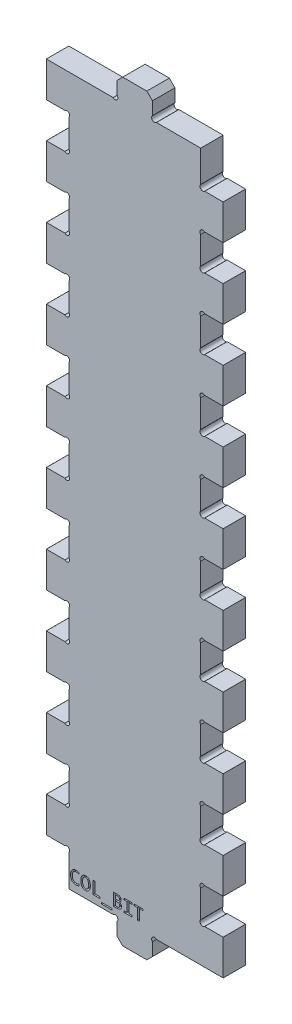
from build123d import *

# Parameters (mm, degrees)
SKETCH1_W           = 50.000000076
SKETCH1_H           = 200.000108
BOSS_EXTRUDE1_DEPTH = 6.35
SKETCH2_W           = 10.0000054
SKETCH2_H           = 6.35
BOSS_EXTRUDE2_DEPTH = 6.35
SKETCH8_W           = 6.35
SKETCH8_H           = 10.0000054
CUT_EXTRUDE6_DEPTH  = 213.416311942
LPATTERN4_COUNT     = 10
LPATTERN4_PITCH     = 20.0000108
SKETCH9_R           = 0.79375
CUT_EXTRUDE7_DEPTH  = 213.416311942
LPATTERN5_COUNT     = 9
LPATTERN5_PITCH     = 20.0000108
SKETCH10_R          = 0.79375
CUT_EXTRUDE8_DEPTH  = 213.416311942
CHAMFER1_SIZE       = 1.5875
SKETCH11_R          = 0.79375
CUT_EXTRUDE10_DEPTH = 213.416311942
SKETCH12_W          = 2.992753623
SKETCH12_H          = 0.405797101
CUT_EXTRUDE11_DEPTH = 2.54
SKETCH14_W          = 6.3240118
SKETCH14_H          = 10.0254054
CUT_EXTRUDE13_DEPTH = 213.416312063
LPATTERN7_COUNT     = 10
LPATTERN7_PITCH     = 20.0000108


with BuildPart() as part:
    # Sketch1 → Boss-Extrude1 (new body)
    with BuildSketch(Plane.XY):
        with Locations((25.000000038, 100.000054)):
            Rectangle(SKETCH1_W, SKETCH1_H)
    extrude(amount=BOSS_EXTRUDE1_DEPTH)

    # Sketch2 → Boss-Extrude2 (add)
    with BuildSketch(Plane.XY):
        with Locations((25.000000038, 203.175108)):
            Rectangle(SKETCH2_W, SKETCH2_H)
        with Locations((25.000000038, -3.175)):
            Rectangle(SKETCH2_W, SKETCH2_H)
    extrude(amount=BOSS_EXTRUDE2_DEPTH)

    # Sketch8 → Cut-Extrude6 (cut, through all)
    with BuildSketch(Plane.XY.offset(6.35)):
        with Locations((3.175, 5.0000027)):
            Rectangle(SKETCH8_W, SKETCH8_H)
        with Locations((46.825000076, 15.0000081)):
            Rectangle(SKETCH8_W, SKETCH8_H)
    cut_extrude6 = extrude(amount=-CUT_EXTRUDE6_DEPTH, mode=Mode.SUBTRACT)

    # LPattern4: Cut-Extrude6 ×10
    with Locations(*[(0, i * LPATTERN4_PITCH, 0) for i in range(1, LPATTERN4_COUNT)]):
        add(cut_extrude6, mode=Mode.SUBTRACT)

    # Sketch9 → Cut-Extrude7 (cut, through all)
    with BuildSketch(Plane.XY.offset(6.35)):
        with Locations((5.788733992, 29.438750192)):
            Circle(SKETCH9_R)
        with Locations((5.788733992, 20.561276808)):
            Circle(SKETCH9_R)
        with Locations((44.211266084, 19.438744792)):
            Circle(SKETCH9_R)
        with Locations((44.211266084, 10.561271408)):
            Circle(SKETCH9_R)
    cut_extrude7 = extrude(amount=-CUT_EXTRUDE7_DEPTH, mode=Mode.SUBTRACT)

    # LPattern5: Cut-Extrude7 ×9
    with Locations(*[(0, i * LPATTERN5_PITCH, 0) for i in range(1, LPATTERN5_COUNT)]):
        add(cut_extrude7, mode=Mode.SUBTRACT)

    # Sketch10 → Cut-Extrude8 (cut, through all)
    with BuildSketch(Plane.XY.offset(6.35)):
        with Locations((5.788733992, 9.438739392)):
            Circle(SKETCH10_R)
        with Locations((44.211266084, 190.561368608)):
            Circle(SKETCH10_R)
    extrude(amount=-CUT_EXTRUDE8_DEPTH, mode=Mode.SUBTRACT)

    # Chamfer1
    chamfer1_edges = [part.edges().sort_by_distance(p)[0] for p in [
        (30.000002738, 206.350108, 3.175),
        (19.999997338, 206.350108, 3.175),
        (19.999997338, -6.35, 3.175),
        (30.000002738, -6.35, 3.175),
    ]]
    chamfer(chamfer1_edges, length=CHAMFER1_SIZE)

    # Sketch11 → Cut-Extrude10 (cut, through all)
    with BuildSketch(Plane.XY):
        with Locations((19.43873133, 200.561374008)):
            Circle(SKETCH11_R)
        with Locations((30.561268746, 200.561374008)):
            Circle(SKETCH11_R)
        with Locations((19.43873133, -0.561266008)):
            Circle(SKETCH11_R)
        with Locations((30.561268746, -0.561266008)):
            Circle(SKETCH11_R)
    extrude(amount=CUT_EXTRUDE10_DEPTH, mode=Mode.SUBTRACT)

    # Sketch12 → Cut-Extrude11 (cut)
    # profile 1 of 7: a face of its own
    with BuildSketch(Plane.XY.offset(6.35)):
        with BuildLine():
            add(Edge.make_bspline(
                [(9.241681159, 2.133449275), (9.172051044, 2.109927689), (9.033143546, 2.063003673), (8.817184861, 2.016258906), (8.596831695, 1.986655982), (8.447883452, 1.983075114), (8.373021739, 1.981275362)],
                knots=[0, 0, 0, 0, 0.994474773, 1.983911717, 2.986709619, 4, 4, 4, 4], degree=3))
            add(Edge.make_bspline(
                [(8.373021739, 1.981275362), (8.313784998, 1.982651993), (8.198372663, 1.985334114), (8.030588838, 2.005924608), (7.873485396, 2.040845672), (7.726600188, 2.089029017), (7.590182892, 2.151662833), (7.464926827, 2.229338836), (7.350037868, 2.320024136), (7.24620649, 2.424813822), (7.15385938, 2.543315104), (7.074810551, 2.676017245), (7.006627123, 2.82128729), (6.953091148, 2.980629134), (6.908673059, 3.15233234), (6.87981115, 3.337634592), (6.861058715, 3.535914739), (6.858793273, 3.672578207), (6.857623188, 3.743163949)],
                knots=[0, 0, 0, 0, 1.072370344, 2.089324368, 3.054894172, 3.982167072, 4.883220536, 5.766007853, 6.644560033, 7.52738623, 8.430658994, 9.357672753, 10.318538922, 11.330575956, 12.396783324, 13.526066154, 14.722230158, 16, 16, 16, 16], degree=3))
            add(Edge.make_bspline(
                [(6.857623188, 3.743163949), (6.859099768, 3.811894194), (6.861991069, 3.946475335), (6.88143919, 4.143226133), (6.91603913, 4.32959635), (6.961848078, 4.505773361), (7.022537455, 4.669882056), (7.093581345, 4.8223251), (7.176989077, 4.961499651), (7.271585267, 5.087672029), (7.37787708, 5.200144093), (7.494493549, 5.299759358), (7.622442393, 5.384896086), (7.759886855, 5.456576142), (7.907409403, 5.513221896), (8.063835069, 5.552992406), (8.228717841, 5.578729312), (8.341483758, 5.581372394), (8.39917663, 5.582724638)],
                knots=[0, 0, 0, 0, 1.219579151, 2.388065895, 3.50339749, 4.580233523, 5.613961845, 6.603771101, 7.560489467, 8.487754287, 9.396405489, 10.300984393, 11.203313264, 12.1174982, 13.046432371, 14.000390303, 14.976967236, 16, 16, 16, 16], degree=3))
            add(Edge.make_bspline(
                [(8.39917663, 5.582724638), (8.438555235, 5.582309343), (8.516057544, 5.581491989), (8.629968521, 5.573830577), (8.739614404, 5.563507882), (8.878962347, 5.54070042), (9.048210995, 5.502545133), (9.177409016, 5.454467772), (9.241681159, 5.430550725)],
                knots=[0, 0, 0, 0, 0.82263702, 1.61905864, 2.384719601, 3.122514214, 4.568537041, 6, 6, 6, 6], degree=3))
            Line((9.241681159, 5.430550725), (9.241681159, 4.974028986))
            add(Edge.make_bspline(
                [(9.241681159, 4.974028986), (9.210428334, 4.990006992), (9.148495702, 5.021670049), (9.052319362, 5.062256406), (8.954683284, 5.096988724), (8.854604056, 5.125716119), (8.752002187, 5.14892655), (8.645079855, 5.16574771), (8.533556351, 5.175104658), (8.457579692, 5.176313541), (8.418990942, 5.176927536)],
                knots=[0, 0, 0, 0, 0.983614603, 1.949194672, 2.923566415, 3.886871985, 4.866016098, 5.870457402, 6.918399582, 8, 8, 8, 8], degree=3))
            add(Edge.make_bspline(
                [(8.418990942, 5.176927536), (8.379540437, 5.176079098), (8.302305834, 5.174418059), (8.189514247, 5.154935509), (8.082072639, 5.126356351), (7.980910785, 5.084530852), (7.886034111, 5.032502436), (7.799180636, 4.967955487), (7.718683438, 4.894297811), (7.646257974, 4.809542217), (7.582015154, 4.714734893), (7.525707459, 4.609928391), (7.476212546, 4.495595378), (7.436612374, 4.370856667), (7.40360209, 4.237288013), (7.381151341, 4.0943738), (7.367596447, 3.942363856), (7.365795755, 3.838037954), (7.364869565, 3.784377717)],
                knots=[0, 0, 0, 0, 0.961408976, 1.882207611, 2.784411545, 3.668921893, 4.545980223, 5.417431557, 6.302341026, 7.202770486, 8.13058038, 9.09095177, 10.101446619, 11.165409356, 12.279999165, 13.455113719, 14.691032636, 16, 16, 16, 16], degree=3))
            add(Edge.make_bspline(
                [(7.364869565, 3.784377717), (7.365523252, 3.728344917), (7.366789278, 3.619823606), (7.379558455, 3.462300155), (7.400914423, 3.315410374), (7.429653576, 3.178771879), (7.46768467, 3.052738296), (7.514340084, 2.937558302), (7.569096818, 2.83261959), (7.632656016, 2.738776906), (7.704247644, 2.655174316), (7.785167308, 2.583964093), (7.872643742, 2.521558623), (7.969623736, 2.473121664), (8.07317629, 2.433337078), (8.185219091, 2.407283692), (8.304581636, 2.389932746), (8.386957714, 2.388043454), (8.429294384, 2.387072464)],
                knots=[0, 0, 0, 0, 1.34450783, 2.603970389, 3.789343747, 4.904814261, 5.951782154, 6.944310538, 7.883053746, 8.786934864, 9.658944679, 10.516661903, 11.367981323, 12.229999549, 13.110838734, 14.024275634, 14.984588823, 16, 16, 16, 16], degree=3))
            add(Edge.make_bspline(
                [(8.429294384, 2.387072464), (8.465779767, 2.387597048), (8.538107423, 2.38863697), (8.645283552, 2.399522956), (8.750137307, 2.415958868), (8.886658962, 2.446880566), (9.053174198, 2.499895316), (9.178890482, 2.559967273), (9.241681159, 2.589971014)],
                knots=[0, 0, 0, 0, 0.776705674, 1.539720753, 2.291683871, 3.035542813, 4.519362263, 6, 6, 6, 6], degree=3))
            Line((9.241681159, 2.589971014), (9.241681159, 2.133449275))
        make_face()
    # profile 2 of 7: a face of its own
    with BuildSketch(Plane.XY.offset(6.35)):
        with BuildLine():
            add(Edge.make_bspline(
                [(12.437333333, 3.804984601), (12.43601793, 3.728845569), (12.433477868, 3.581820029), (12.412555032, 3.36938994), (12.379376875, 3.172756522), (12.330969947, 2.992228254), (12.270207249, 2.827841825), (12.201632231, 2.677433039), (12.122296119, 2.542200367), (12.033425875, 2.421642575), (11.93521557, 2.316801835), (11.83024605, 2.224639641), (11.715040792, 2.149760737), (11.593748947, 2.087488378), (11.46639255, 2.040198208), (11.335297313, 2.005802001), (11.200480678, 1.985740262), (11.109574639, 1.982770552), (11.063805254, 1.981275362)],
                knots=[0, 0, 0, 0, 1.423082774, 2.747992794, 3.986236128, 5.147128242, 6.236197569, 7.259302453, 8.233395673, 9.161912359, 10.053001658, 10.914402565, 11.766421957, 12.614596425, 13.458547256, 14.300675266, 15.144423756, 16, 16, 16, 16], degree=3))
            add(Edge.make_bspline(
                [(11.063805254, 1.981275362), (11.00982167, 1.982748877), (10.90503797, 1.985609012), (10.753247627, 2.009107372), (10.61209879, 2.046739236), (10.481460474, 2.10014703), (10.362354069, 2.168847955), (10.253014391, 2.250313215), (10.155178714, 2.346380358), (10.067688025, 2.455479173), (9.991225346, 2.57801454), (9.925820989, 2.713217929), (9.870217267, 2.860721403), (9.825427788, 3.020431097), (9.790831632, 3.191607172), (9.766862896, 3.373545929), (9.751248041, 3.565618457), (9.749713701, 3.697162748), (9.748927536, 3.764563406)],
                knots=[0, 0, 0, 0, 1.030115455, 1.999483942, 2.924432069, 3.813267415, 4.685316872, 5.542716903, 6.40939724, 7.295524004, 8.206506083, 9.160640047, 10.158252241, 11.211975818, 12.323750963, 13.4892538, 14.713543989, 16, 16, 16, 16], degree=3))
            add(Edge.make_bspline(
                [(9.748927536, 3.764563406), (9.75034993, 3.839899952), (9.753100111, 3.985562242), (9.772663246, 4.196517882), (9.806314436, 4.391935553), (9.85387434, 4.571929), (9.913447346, 4.736363234), (9.982511501, 4.886261547), (10.060393977, 5.02196585), (10.149995451, 5.1415857), (10.248069311, 5.246740581), (10.353150126, 5.338639822), (10.467324173, 5.414475143), (10.587959001, 5.476661318), (10.71489283, 5.523635893), (10.845647532, 5.558318613), (10.980237662, 5.578238608), (11.071140058, 5.581222372), (11.116907609, 5.582724638)],
                knots=[0, 0, 0, 0, 1.41309666, 2.732205102, 3.969807196, 5.128608405, 6.219709524, 7.24631839, 8.221244419, 9.148965463, 10.043106611, 10.914447659, 11.761129373, 12.607796584, 13.454637821, 14.294855332, 15.141493535, 16, 16, 16, 16], degree=3))
            add(Edge.make_bspline(
                [(11.116907609, 5.582724638), (11.17088216, 5.581205794), (11.27590958, 5.578250322), (11.427896122, 5.555314891), (11.568904598, 5.516302026), (11.699067312, 5.462137448), (11.818768671, 5.393499895), (11.927876493, 5.311457627), (12.026657504, 5.216102795), (12.113534025, 5.106814066), (12.190935518, 4.985092958), (12.258438921, 4.851223539), (12.313370706, 4.70389839), (12.359381712, 4.54523559), (12.394485192, 4.375040237), (12.419706837, 4.194233125), (12.434935452, 4.003127673), (12.436520905, 3.872117664), (12.437333333, 3.804984601)],
                knots=[0, 0, 0, 0, 1.031800753, 2.007749398, 2.930678117, 3.822900438, 4.696376593, 5.562252438, 6.426830471, 7.314406963, 8.225311853, 9.18096675, 10.175487812, 11.227471919, 12.337140194, 13.495232744, 14.716489688, 16, 16, 16, 16], degree=3))
        make_face()
        with BuildLine():
            add(Edge.make_bspline(
                [(11.930086957, 3.770903986), (11.929319843, 3.821632923), (11.927816655, 3.921038275), (11.920712966, 4.066869863), (11.904833817, 4.205823063), (11.885807956, 4.337988389), (11.860060806, 4.462613221), (11.826549375, 4.578507216), (11.787612768, 4.686148555), (11.739840943, 4.784056517), (11.685155945, 4.872228152), (11.623993703, 4.951423441), (11.5538972, 5.018635198), (11.476994298, 5.07596847), (11.392299535, 5.121667179), (11.299078477, 5.154455719), (11.197470152, 5.173515246), (11.127028826, 5.175767608), (11.090752717, 5.176927536)],
                knots=[0, 0, 0, 0, 1.323673599, 2.593790554, 3.807090586, 4.970987518, 6.076778004, 7.123914636, 8.116191169, 9.059475772, 9.960330598, 10.819370074, 11.662669578, 12.485668992, 13.315223066, 14.163241623, 15.054100047, 16, 16, 16, 16], degree=3))
            add(Edge.make_bspline(
                [(11.090752717, 5.176927536), (11.055535534, 5.175461751), (10.986900043, 5.172605053), (10.887318918, 5.153125777), (10.79613613, 5.117548722), (10.712780008, 5.069316432), (10.637158324, 5.009558746), (10.569697125, 4.938452065), (10.507410026, 4.859424967), (10.453429163, 4.769728909), (10.407632774, 4.671137643), (10.365331906, 4.565176701), (10.332511626, 4.450170111), (10.303471352, 4.328407128), (10.282685987, 4.200398216), (10.267948451, 4.068117388), (10.257856916, 3.931950555), (10.256740918, 3.839876258), (10.256173913, 3.793096014)],
                knots=[0, 0, 0, 0, 0.938104053, 1.828290259, 2.688226573, 3.533173995, 4.38495139, 5.245952462, 6.138444459, 7.060521377, 8.026891732, 9.031849607, 10.096184638, 11.209149641, 12.36492099, 13.547735175, 14.754076334, 16, 16, 16, 16], degree=3))
            add(Edge.make_bspline(
                [(10.256173913, 3.793096014), (10.256797119, 3.741828752), (10.258012335, 3.641860407), (10.267069923, 3.495124897), (10.280750161, 3.355393901), (10.301327316, 3.222814719), (10.327849907, 3.098556572), (10.361167952, 2.983052236), (10.400604405, 2.876287784), (10.446937421, 2.778509345), (10.501329196, 2.690699423), (10.561953655, 2.611969745), (10.632088589, 2.54552854), (10.707136232, 2.48699193), (10.792035817, 2.442375974), (10.884293742, 2.409741059), (10.985072207, 2.39040114), (11.054737023, 2.388206869), (11.090752717, 2.387072464)],
                knots=[0, 0, 0, 0, 1.340540585, 2.613980496, 3.843097936, 5.010722051, 6.120504555, 7.163418743, 8.151508278, 9.093960035, 9.987380757, 10.848401497, 11.683877306, 12.507385072, 13.329500698, 14.179475102, 15.05881515, 16, 16, 16, 16], degree=3))
            add(Edge.make_bspline(
                [(11.090752717, 2.387072464), (11.126001249, 2.388400933), (11.194492349, 2.390982269), (11.293349403, 2.412252809), (11.384928334, 2.446356466), (11.468688325, 2.494724667), (11.545078889, 2.554430013), (11.613424744, 2.625274866), (11.675644785, 2.704784284), (11.730268109, 2.794425908), (11.778269739, 2.892425457), (11.819561695, 2.998825819), (11.854377033, 3.112719034), (11.881459116, 3.234495751), (11.903948197, 3.361899639), (11.918251486, 3.494578643), (11.928424315, 3.631253151), (11.929526842, 3.723858103), (11.930086957, 3.770903986)],
                knots=[0, 0, 0, 0, 0.936906737, 1.820494917, 2.676828052, 3.526792157, 4.383009914, 5.247809723, 6.13916262, 7.06372975, 8.034989121, 9.038664354, 10.096936984, 11.200050273, 12.355522744, 13.536827286, 14.74863997, 16, 16, 16, 16], degree=3))
        make_face(mode=Mode.SUBTRACT)
    # profile 3 of 7: a face of its own
    with BuildSketch(Plane.XY.offset(6.35)):
        Polygon((15.227188406, 2.032), (13.198202899, 2.032), (13.198202899, 5.532), (13.705449275, 5.532), (13.705449275, 2.437797101), (15.227188406, 2.437797101), align=None)
    # profile 4 of 7: a face of its own
    with BuildSketch(Plane.XY.offset(6.35)):
        with Locations((17.078637682, 1.118956522)):
            Rectangle(SKETCH12_W, SKETCH12_H)
    # profile 5 of 7: a face of its own
    with BuildSketch(Plane.XY.offset(6.35)):
        with BuildLine():
            add(Edge.make_bspline(
                [(21.26342029, 3.091669384), (21.262206874, 3.050385061), (21.259837655, 2.969776577), (21.241270646, 2.852775616), (21.211235382, 2.742746616), (21.168333223, 2.640303308), (21.113702402, 2.545643546), (21.050317486, 2.457397294), (20.975070473, 2.377922201), (20.889772489, 2.306440675), (20.794858812, 2.242795359), (20.690596084, 2.18748094), (20.577130482, 2.139609619), (20.454547718, 2.10036785), (20.323837889, 2.069809065), (20.185911584, 2.047353759), (20.04070608, 2.035042856), (19.941431185, 2.033029281), (19.890684783, 2.032)],
                knots=[0, 0, 0, 0, 1.013216857, 1.978326566, 2.900521816, 3.80762901, 4.696652207, 5.578905641, 6.469134838, 7.376056482, 8.306156408, 9.269586241, 10.269510869, 11.325927403, 12.425683058, 13.562442612, 14.753992443, 16, 16, 16, 16], degree=3))
            Line((19.890684783, 2.032), (18.980811594, 2.032))
            Line((18.980811594, 2.032), (18.980811594, 5.532))
            Line((18.980811594, 5.532), (19.986586051, 5.532))
            add(Edge.make_bspline(
                [(19.986586051, 5.532), (20.034164889, 5.531535569), (20.126272402, 5.530636482), (20.25954255, 5.519667014), (20.38379881, 5.504518722), (20.498914496, 5.481893726), (20.604628307, 5.451308424), (20.701959554, 5.416405711), (20.789572443, 5.373426153), (20.867919253, 5.323958732), (20.937781399, 5.26853573), (20.99745473, 5.205137465), (21.048789581, 5.135944546), (21.090264233, 5.059534502), (21.122872976, 4.97679493), (21.145711635, 4.887338631), (21.159224876, 4.791622), (21.1610388, 4.725734298), (21.161971014, 4.691873188)],
                knots=[0, 0, 0, 0, 1.388776146, 2.688521212, 3.90167895, 5.042289038, 6.109239049, 7.11226345, 8.057476407, 8.951978552, 9.813306123, 10.653548746, 11.486644475, 12.322022467, 13.184316581, 14.076721024, 15.011585489, 16, 16, 16, 16], degree=3))
            add(Edge.make_bspline(
                [(21.161971014, 4.691873188), (21.160326095, 4.64683958), (21.157124584, 4.559190529), (21.131358633, 4.432414464), (21.088347643, 4.315599145), (21.038497604, 4.226419604), (20.989790174, 4.161446482), (20.947487409, 4.116089651), (20.899726236, 4.07422866), (20.847102918, 4.035062702), (20.78894801, 3.999417594), (20.725302523, 3.966972848), (20.656409422, 3.937652339), (20.608077101, 3.921184705), (20.583393116, 3.912774457)],
                knots=[0, 0, 0, 0, 1.542514348, 3.00220039, 4.41170875, 5.794260582, 6.486040375, 7.190794555, 7.915677968, 8.659981338, 9.436469499, 10.250434215, 11.106472525, 12, 12, 12, 12], degree=3))
            add(Edge.make_bspline(
                [(20.583393116, 3.912774457), (20.628484999, 3.902011395), (20.718538493, 3.880516367), (20.824559751, 3.832821667), (20.9046532, 3.787275686), (20.960505709, 3.746913217), (21.012991814, 3.702676214), (21.061460622, 3.653252693), (21.105957568, 3.599317646), (21.145909364, 3.540610374), (21.17962912, 3.476415301), (21.210348606, 3.40855291), (21.233765254, 3.335373771), (21.251446717, 3.258016238), (21.261838218, 3.176230754), (21.262885916, 3.120231516), (21.26342029, 3.091669384)],
                knots=[0, 0, 0, 0, 1.670885493, 3.336943679, 4.174711656, 4.995358125, 5.821090152, 6.65083528, 7.491206374, 8.34319308, 9.209637874, 10.10658404, 11.029731221, 11.978595832, 12.968992875, 14, 14, 14, 14], degree=3))
        make_face()
        with BuildLine():
            add(Edge.make_bspline(
                [(20.654724638, 4.626089674), (20.653268922, 4.660048449), (20.650410745, 4.726723694), (20.629853277, 4.807369738), (20.60577815, 4.867736504), (20.581410006, 4.909565534), (20.550277635, 4.947626652), (20.513697298, 4.982326322), (20.47131988, 5.014695154), (20.421405122, 5.042180728), (20.36483904, 5.066681783), (20.301250998, 5.08803203), (20.230013805, 5.105576987), (20.150244735, 5.118164465), (20.061734794, 5.124904903), (19.999806596, 5.125758488), (19.967564312, 5.126202899)],
                knots=[0, 0, 0, 0, 1.467350645, 2.88102155, 3.572915596, 4.274650825, 4.965411238, 5.692918483, 6.45179769, 7.26549663, 8.150919223, 9.115896111, 10.16367939, 11.321101063, 12.605258578, 14, 14, 14, 14], degree=3))
            Line((19.967564312, 5.126202899), (19.488057971, 5.126202899))
            Line((19.488057971, 5.126202899), (19.488057971, 4.060985507))
            Line((19.488057971, 4.060985507), (19.951712862, 4.060985507))
            add(Edge.make_bspline(
                [(19.951712862, 4.060985507), (20.002285049, 4.062611875), (20.099055898, 4.065723962), (20.216147577, 4.086765768), (20.301517596, 4.111515143), (20.358599399, 4.137176304), (20.41260192, 4.164115364), (20.460714748, 4.197950935), (20.504926514, 4.235239355), (20.543723416, 4.277339872), (20.577520292, 4.323740657), (20.605294605, 4.37495064), (20.627715016, 4.430716224), (20.643369893, 4.491444911), (20.653097322, 4.557085787), (20.654169282, 4.602540649), (20.654724638, 4.626089674)],
                knots=[0, 0, 0, 0, 2.073538655, 3.967755928, 4.862618563, 5.712230629, 6.531505899, 7.334196252, 8.118305519, 8.900614993, 9.67674368, 10.467342855, 11.284464589, 12.136217, 13.034420764, 14, 14, 14, 14], degree=3))
        make_face(mode=Mode.SUBTRACT)
        with BuildLine():
            add(Edge.make_bspline(
                [(20.756173913, 3.073440217), (20.755647901, 3.095409939), (20.75461508, 3.138547266), (20.744008243, 3.201632751), (20.726622508, 3.261208573), (20.702479543, 3.317243877), (20.672659966, 3.369761334), (20.635535005, 3.417440346), (20.593216354, 3.46182108), (20.543973189, 3.50116604), (20.488901208, 3.535846195), (20.428855844, 3.567181811), (20.363071871, 3.593997671), (20.291680265, 3.615962893), (20.215122291, 3.633476451), (20.133785421, 3.645755118), (20.047525473, 3.654174021), (19.988456872, 3.654843708), (19.958053442, 3.655188406)],
                knots=[0, 0, 0, 0, 0.948445084, 1.862262358, 2.754366203, 3.623615494, 4.492864785, 5.355796555, 6.227589923, 7.136690505, 8.070741307, 9.035595869, 10.059344591, 11.135152229, 12.259281394, 13.44900263, 14.686966176, 16, 16, 16, 16], degree=3))
            Line((19.958053442, 3.655188406), (19.488057971, 3.655188406))
            Line((19.488057971, 3.655188406), (19.488057971, 2.437797101))
            Line((19.488057971, 2.437797101), (19.973904891, 2.437797101))
            add(Edge.make_bspline(
                [(19.973904891, 2.437797101), (20.005888391, 2.438205025), (20.067562755, 2.438991631), (20.156998315, 2.446376497), (20.240296172, 2.457661851), (20.317011117, 2.475295336), (20.387587557, 2.496678652), (20.452238956, 2.522399519), (20.51001783, 2.554509234), (20.562555926, 2.59002351), (20.608081503, 2.631962755), (20.648155941, 2.678825178), (20.681482963, 2.731906471), (20.709289471, 2.789819802), (20.730794466, 2.853143616), (20.745694706, 2.921734069), (20.754290456, 2.995813426), (20.755532351, 3.046998183), (20.756173913, 3.073440217)],
                knots=[0, 0, 0, 0, 1.326701194, 2.558302104, 3.720902774, 4.811133236, 5.820090824, 6.778795896, 7.691204955, 8.557756331, 9.403467856, 10.251165954, 11.10865784, 11.996033528, 12.91113804, 13.8765245, 14.903013039, 16, 16, 16, 16], degree=3))
        make_face(mode=Mode.SUBTRACT)
    # profile 6 of 7: a face of its own
    with BuildSketch(Plane.XY.offset(6.35)):
        Polygon((22.835884058, 5.126202899), (22.024289855, 5.126202899), (22.024289855, 5.532), (24.154724638, 5.532), (24.154724638, 5.126202899), (23.343130435, 5.126202899), (23.343130435, 2.437797101), (24.154724638, 2.437797101), (24.154724638, 2.032), (22.024289855, 2.032), (22.024289855, 2.437797101), (22.835884058, 2.437797101), align=None)
    # profile 7 of 7: a face of its own
    with BuildSketch(Plane.XY.offset(6.35)):
        Polygon((27.350376812, 5.126202899), (26.335884058, 5.126202899), (26.335884058, 2.032), (25.828637681, 2.032), (25.828637681, 5.126202899), (24.814144928, 5.126202899), (24.814144928, 5.532), (27.350376812, 5.532), align=None)
    extrude(amount=-CUT_EXTRUDE11_DEPTH, mode=Mode.SUBTRACT)

    # Sketch14 → Cut-Extrude13 (cut, through all)
    with BuildSketch(Plane.XY.offset(6.35)):
        with Locations((3.175, 5.0000027)):
            Rectangle(SKETCH14_W, SKETCH14_H)
        with Locations((46.825000076, 15.0000081)):
            Rectangle(SKETCH14_W, SKETCH14_H)
    cut_extrude13 = extrude(amount=-CUT_EXTRUDE13_DEPTH, mode=Mode.SUBTRACT)

    # LPattern7: Cut-Extrude13 ×10
    with Locations(*[(0, i * LPATTERN7_PITCH, 0) for i in range(1, LPATTERN7_COUNT)]):
        add(cut_extrude13, mode=Mode.SUBTRACT)


solid = part.part
